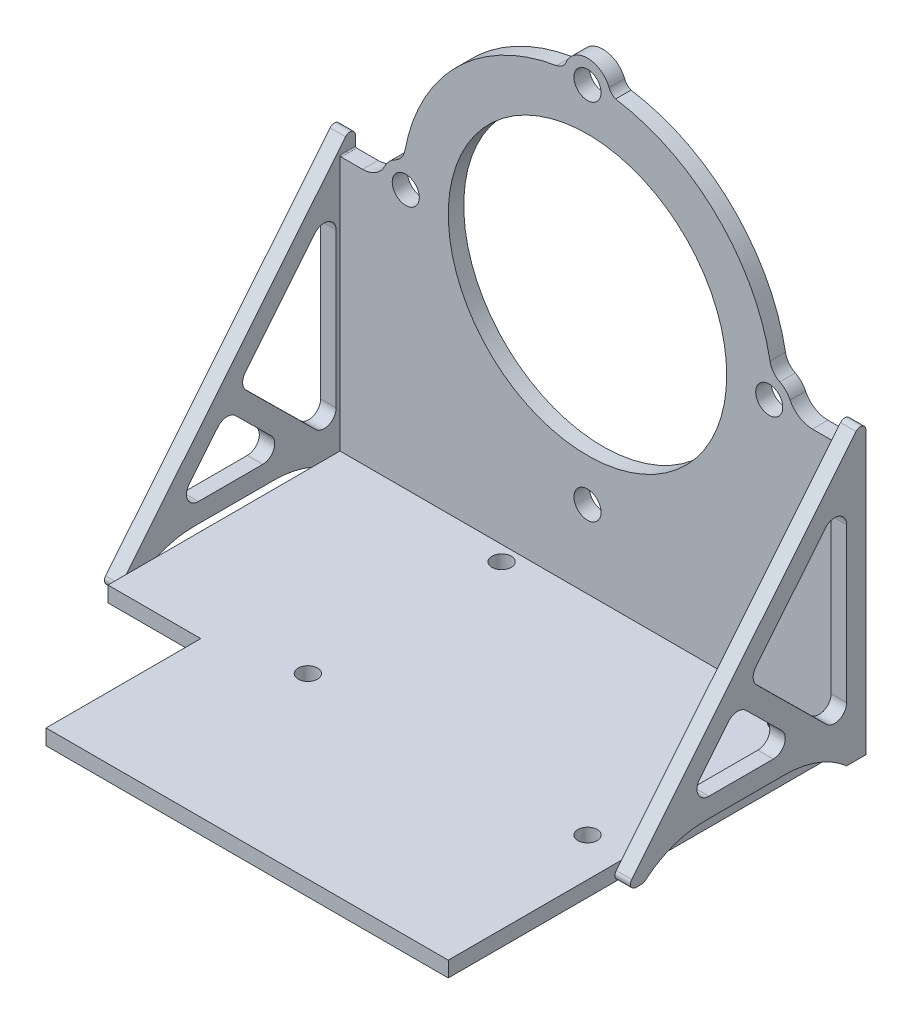
from build123d import *

# Parameters (mm, degrees)
BOSS_EXTRUDE1_DEPTH = 6.35
SKETCH3_W           = 203.2
SKETCH3_H           = 190.5
BOSS_EXTRUDE2_DEPTH = 6.35
SKETCH4_R           = 57.15
CUT_EXTRUDE1_DEPTH  = 6.35
SKETCH5_R           = 5.55625
CUT_EXTRUDE2_DEPTH  = 6.35
CUT_EXTRUDE3_DEPTH  = 6.35
SKETCH7_R           = 3.96875
CUT_EXTRUDE4_DEPTH  = 6.35
BOSS_EXTRUDE3_DEPTH = 6.35
BOSS_EXTRUDE4_DEPTH = 6.35
CUT_EXTRUDE5_DEPTH  = 6.35
CUT_EXTRUDE6_START  = -6.35
CUT_EXTRUDE6_DEPTH  = 6.35
CUT_EXTRUDE7_DEPTH  = 336.582808568
FILLET1_R           = 4.92
FILLET4_R           = 2.286
FILLET6_R           = 0.508


with BuildPart() as part:
    # Sketch2 → Boss-Extrude1 (new body)
    with BuildSketch(Plane(origin=(0, 0, 0), x_dir=(1, 0, 0), z_dir=(0, 1, 0))):
        Polygon((0, 0), (0, -101.6), (38.1, -101.6), (38.1, -165.1), (203.2, -165.1), (203.2, 0), align=None)
    extrude(amount=BOSS_EXTRUDE1_DEPTH)

    # Sketch3 → Boss-Extrude2 (add)
    with BuildSketch(Plane.XY):
        with Locations((101.6, 101.6)):
            Rectangle(SKETCH3_W, SKETCH3_H)
    extrude(amount=BOSS_EXTRUDE2_DEPTH)

    # Sketch4 → Cut-Extrude1 (cut)
    with BuildSketch(Plane.XY.offset(6.35)):
        with Locations((101.6, 112.7125)):
            Circle(SKETCH4_R)
    extrude(amount=-CUT_EXTRUDE1_DEPTH, mode=Mode.SUBTRACT)

    # Sketch5 → Cut-Extrude2 (cut)
    with BuildSketch(Plane(origin=(0, 0, 0), x_dir=(-1, 0, 0), z_dir=(0, 0, -1))):
        with Locations((-101.6, 38.1125)):
            Circle(SKETCH5_R)
        with Locations((-101.6, 187.3125)):
            Circle(SKETCH5_R)
        with Locations((-27, 112.7125)):
            Circle(SKETCH5_R)
        with Locations((-176.2, 112.7125)):
            Circle(SKETCH5_R)
    extrude(amount=-CUT_EXTRUDE2_DEPTH, mode=Mode.SUBTRACT)

    # Sketch6 → Cut-Extrude3 (cut)
    with BuildSketch(Plane(origin=(0, 0, 0), x_dir=(-1, 0, 0), z_dir=(0, 0, -1))):
        with BuildLine():
            Line((0, 111.125), (-9.279631247, 111.125))
            ThreePointArc((-9.279631247, 111.125), (-14.677432472, 112.677483405), (-18.425628023, 116.860483871))
            ThreePointArc((-18.425628023, 116.860483871), (-20.187748704, 119.369740966), (-22.655788744, 121.189141644))
            ThreePointArc((-22.655788744, 121.189141644), (-25.29180212, 123.419037006), (-26.673108853, 126.583368145))
            ThreePointArc((-26.673108853, 126.583368145), (-48.154111696, 167.026190939), (-88.937645626, 187.853066818))
            ThreePointArc((-88.937645626, 187.853066818), (-91.211372645, 188.851802141), (-92.739976476, 190.809013713))
            ThreePointArc((-92.739976476, 190.809013713), (-101.6, 196.8375), (-110.460023524, 190.809013713))
            ThreePointArc((-110.460023524, 190.809013713), (-111.511997393, 189.164869891), (-113.106279584, 188.038760561))
            ThreePointArc((-113.106279584, 188.038760561), (-154.627017311, 167.435214069), (-176.526891147, 126.583368145))
            ThreePointArc((-176.526891147, 126.583368145), (-177.90819788, 123.419037006), (-180.544211256, 121.189141644))
            ThreePointArc((-180.544211256, 121.189141644), (-183.012251296, 119.369740966), (-184.774371977, 116.860483871))
            ThreePointArc((-184.774371977, 116.860483871), (-188.522567528, 112.677483405), (-193.920368753, 111.125))
            Line((-193.920368753, 111.125), (-203.2, 111.125))
            Line((-203.2, 111.125), (-224.605111479, 111.125))
            Line((-224.605111479, 111.125), (-224.605111479, 212.995219786))
            Line((-224.605111479, 212.995219786), (24.443830007, 212.995219786))
            Line((24.443830007, 212.995219786), (24.443830007, 111.125))
            Line((24.443830007, 111.125), (0, 111.125))
        make_face()
    extrude(amount=-CUT_EXTRUDE3_DEPTH, mode=Mode.SUBTRACT)

    # Sketch7 → Cut-Extrude4 (cut)
    with BuildSketch(Plane(origin=(0, 6.35, 0), x_dir=(1, 0, 0), z_dir=(0, 1, 0))):
        with Locations(Location((187.325, -92.05, 0), (0, 0, 270))):
            Circle(SKETCH7_R)
        with Locations(Location((187.325, -12.55, 0), (0, 0, 270))):
            Circle(SKETCH7_R)
        with Locations(Location((72.525, -12.55, 0), (0, 0, 270))):
            Circle(SKETCH7_R)
        with Locations(Location((72.525, -92.05, 0), (0, 0, 270))):
            Circle(SKETCH7_R)
    extrude(amount=-CUT_EXTRUDE4_DEPTH, mode=Mode.SUBTRACT)

    # Sketch8 → Boss-Extrude3 (add)
    with BuildSketch(Plane(origin=(0, 0, 0), x_dir=(0, 0, -1), z_dir=(1, 0, 0))):
        Polygon((0, 0), (-99.21875, 0), (0, 121.92), align=None)
    extrude(amount=-BOSS_EXTRUDE3_DEPTH)

    # Sketch10 → Boss-Extrude4 (add)
    with BuildSketch(Plane(origin=(203.2, 0, 0), x_dir=(0, 0, -1), z_dir=(1, 0, 0))):
        Polygon((-99.21875, 0), (0, 0), (0, 121.92), align=None)
    extrude(amount=BOSS_EXTRUDE4_DEPTH)

    # Sketch11 → Cut-Extrude5 (cut)
    with BuildSketch(Plane(origin=(209.55, 0, 0), x_dir=(0, 0, -1), z_dir=(1, 0, 0))):
        with BuildLine():
            Line((-7.9375, 0), (-91.28125, 0))
            ThreePointArc((-91.28125, 0), (-79.550852944, 7.064286609), (-66.080468762, 9.525))
            Line((-66.080468762, 9.525), (-33.138281238, 9.525))
            ThreePointArc((-33.138281238, 9.525), (-19.667897056, 7.064286609), (-7.9375, 0))
        make_face()
    extrude(amount=-CUT_EXTRUDE5_DEPTH, mode=Mode.SUBTRACT)

    # Sketch12 → Cut-Extrude6 (cut)
    with BuildSketch(Plane.ZY.offset(6.35).offset(CUT_EXTRUDE6_START)):
        with BuildLine():
            Line((91.28125, 0), (7.9375, 0))
            ThreePointArc((7.9375, 0), (19.667897056, 7.064286609), (33.138281238, 9.525))
            Line((33.138281238, 9.525), (66.080468762, 9.525))
            ThreePointArc((66.080468762, 9.525), (79.550852944, 7.064286609), (91.28125, 0))
        make_face()
    extrude(amount=CUT_EXTRUDE6_DEPTH, mode=Mode.SUBTRACT)

    # Sketch13 → Cut-Extrude7 (cut, through all)
    with BuildSketch(Plane(origin=(209.55, 0, 0), x_dir=(0, 0, -1), z_dir=(1, 0, 0))):
        Polygon((-7.9375, 99.591161664), (-7.9375, 10.691161664), (-48.018748286, 50.339323771), align=None)
        Polygon((-53.052501721, 44.153847549), (-26.069598319, 17.4625), (-74.773975963, 17.4625), align=None)
    extrude(amount=-CUT_EXTRUDE7_DEPTH, mode=Mode.SUBTRACT)

    # Fillet1
    fillet1_edges = [part.edges().sort_by_distance(p)[0] for p in [
        (206.375, 50.339323771, 48.018748286),
        (-3.175, 50.339323771, 48.018748286),
        (206.375, 99.591161664, 7.9375),
        (-3.175, 99.591161664, 7.9375),
        (206.375, 10.691161664, 7.9375),
        (-3.175, 10.691161664, 7.9375),
        (206.375, 44.153847549, 53.052501721),
        (-3.175, 44.153847549, 53.052501721),
        (206.375, 17.4625, 26.069598319),
        (-3.175, 17.4625, 26.069598319),
        (206.375, 17.4625, 74.773975963),
        (-3.175, 17.4625, 74.773975963),
    ]]
    fillet(fillet1_edges, radius=FILLET1_R)

    # Fillet4
    fillet4_edges = [part.edges().sort_by_distance(p)[0] for p in [
        (-3.175, 121.92, 0),
        (-3.175, 0, 99.21875),
        (206.375, 121.92, 0),
        (206.375, 0, 99.21875),
        (206.375, 0, 91.28125),
        (-3.175, 0, 91.28125),
    ]]
    fillet(fillet4_edges, radius=FILLET4_R)

    # Fillet6
    fillet6_edges = [part.edges().sort_by_distance(p)[0] for p in [
        (0, 111.125, 3.175),
    ]]
    fillet(fillet6_edges, radius=FILLET6_R)


solid = part.part
